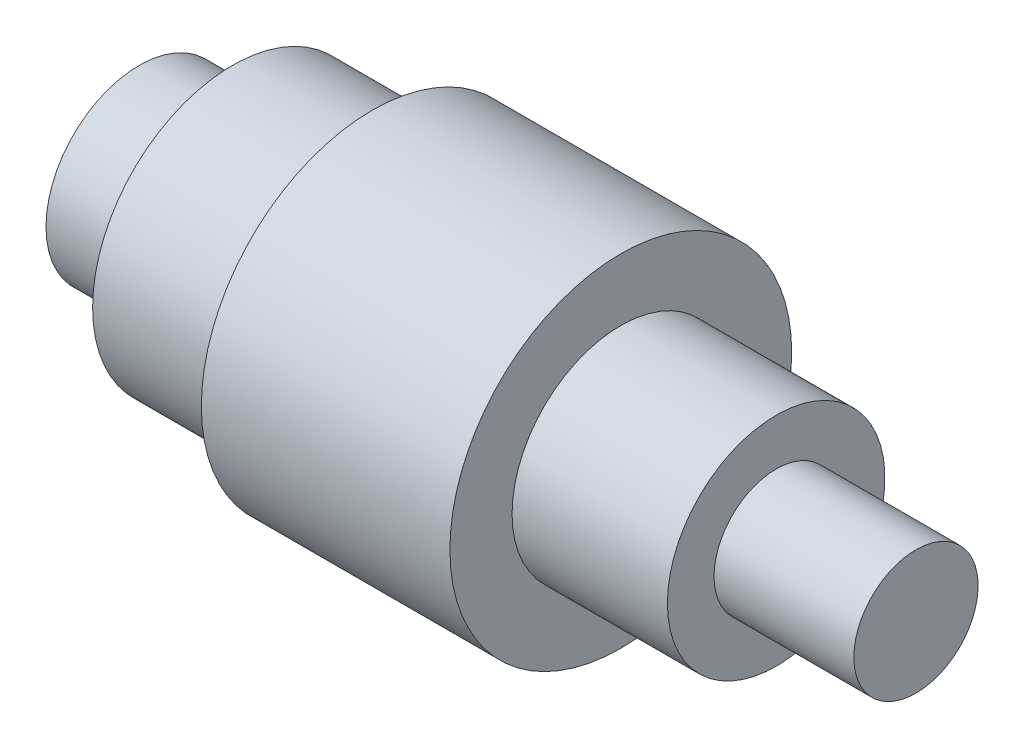
from build123d import *


with BuildPart() as part:
    # Esboço1 → Revolução2 (revolve)
    with BuildSketch(Plane.XY, mode=Mode.PRIVATE) as revolu_o2_sk:
        Polygon((0, 0), (250, 0), (250, 20), (205, 20), (205, 35), (155, 35), (155, 55), (75, 55), (75, 45), (30, 45), (30, 30), (0, 30), align=None)
    revolve(revolu_o2_sk.sketch.rotate(Axis((0, 0, 0), (1, 0, 0)), 90), axis=Axis((0, 0, 0), (1, 0, 0)))


solid = part.part
